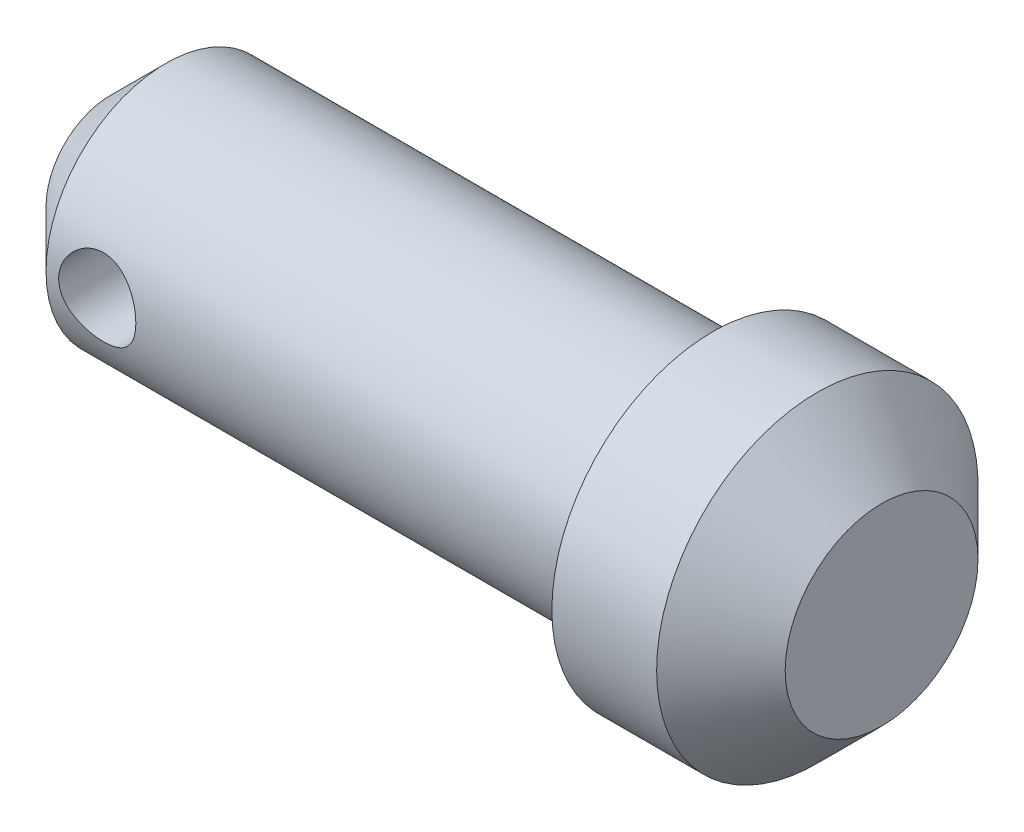
from build123d import *

# Parameters (mm, degrees)
CUT_EXTRUDE1_DEPTH      = 126.099960032
CUT_EXTRUDE1_DEPTH_BACK = 126.099960032
SKETCH3_R               = 6


with BuildPart() as part:
    # Sketch2 → Revolve1 (revolve)
    with BuildSketch(Plane.XY, mode=Mode.PRIVATE) as revolve1_sk:
        Polygon((0, 0), (120, 0), (120, -15), (110, -25), (93.7, -25), (93.7, -18.7), (8.7, -18.7), (0, -10), align=None)
    revolve(revolve1_sk.sketch.rotate(Axis((0, 0, 0), (1, 0, 0)), 270), axis=Axis((0, 0, 0), (1, 0, 0)))

    # Sketch3 → Cut-Extrude1 (cut, two sides: drawn at the far end of the back side and taken through both)
    with BuildSketch(Plane.XY.offset(-CUT_EXTRUDE1_DEPTH_BACK)):
        with Locations((16.669361572, 0)):
            Circle(SKETCH3_R)
    extrude(amount=CUT_EXTRUDE1_DEPTH + CUT_EXTRUDE1_DEPTH_BACK, mode=Mode.SUBTRACT)


solid = part.part
